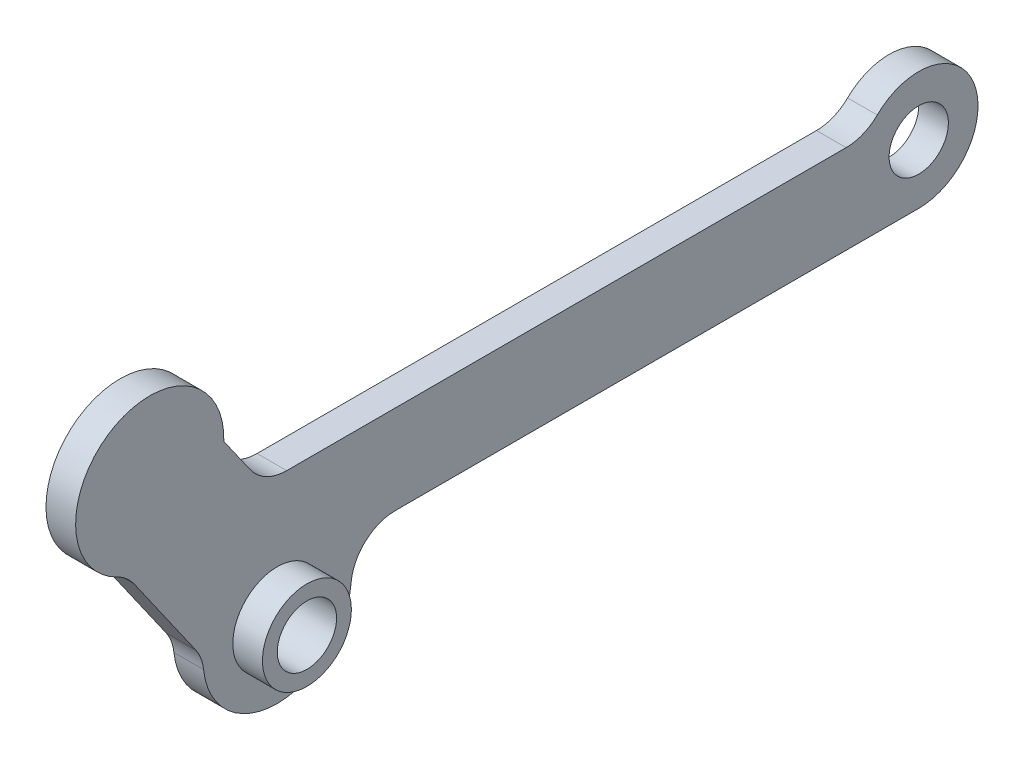
from build123d import *

# Parameters (mm, degrees)
EXTRUDE_1_DEPTH          = 2
EXTRUDE_START            = 2
SKETCH_1_4_R             = 3
EXTRUDE_2_DEPTH          = 2
CUT_EXTRUDE_1_DEPTH      = 51.160727735
CUT_EXTRUDE_1_DEPTH_BACK = 51.160727735
SKETCH_1_3_R             = 2
FILLET_1_R               = 3
SKETCH_2_R               = 2
EXTRUDE_3_DEPTH          = 2
SKETCH_2_3_R             = 1.8
EXTRUDE_4_DEPTH          = 2


with BuildPart() as part:
    # 草图1 → 凸台-拉伸1 (new body)
    with BuildSketch(Plane(origin=(0, 0, 0), x_dir=(0, 0, -1), z_dir=(1, 0, 0))):
        with BuildLine():
            Line((40.737143614, 0), (0, 0))
            Line((0, 0), (2.48051592, -3.542543867))
            ThreePointArc((2.48051592, -3.542543867), (4.165783411, -4.487079684), (5.367176995, -6))
            Line((5.367176995, -6), (44.201245229, -6))
            ThreePointArc((44.201245229, -6), (40.737143614, -4), (40.737143614, 0))
        make_face()
        with BuildLine():
            Line((2.48051592, -3.542543867), (0, 0))
            Line((0, 0), (-2.681672007, 3.829824531))
            ThreePointArc((-2.681672007, 3.829824531), (-4.811127311, -0.102785303), (-9.234888361, -0.758786959))
            Line((-9.234888361, -0.758786959), (-4.072700434, -8.131155358))
            ThreePointArc((-4.072700434, -8.131155358), (-1.94324513, -4.198545524), (2.48051592, -3.542543867))
        make_face()
        with BuildLine():
            ThreePointArc((48.201245229, -2), (45.23652141, 1.863703305), (40.737143614, 0))
            Line((40.737143614, 0), (44.201245229, 0))
            ThreePointArc((44.201245229, 0), (45.615458792, -0.585786438), (46.201245229, -2))
            ThreePointArc((46.201245229, -2), (45.615458792, -3.414213562), (44.201245229, -4))
            Line((44.201245229, -4), (44.201245229, -6))
            ThreePointArc((44.201245229, -6), (47.029672354, -4.828427125), (48.201245229, -2))
        make_face()
        with BuildLine():
            Line((44.201245229, 0), (40.737143614, 0))
            ThreePointArc((40.737143614, 0), (40.737143614, -4), (44.201245229, -6))
            Line((44.201245229, -6), (44.201245229, -4))
            ThreePointArc((44.201245229, -4), (42.201245229, -2), (44.201245229, 0))
        make_face()
        with BuildLine():
            ThreePointArc((5.367176995, -6), (4.165783411, -4.487079684), (2.48051592, -3.542543867))
            Line((2.48051592, -3.542543867), (4.201245229, -6))
            Line((4.201245229, -6), (5.367176995, -6))
        make_face()
        with BuildLine():
            Line((4.201245229, -6), (2.48051592, -3.542543867))
            ThreePointArc((2.48051592, -3.542543867), (-1.94324513, -4.198545524), (-4.072700434, -8.131155358))
            Line((-4.072700434, -8.131155358), (-2.351971125, -10.588611491))
            Line((-2.351971125, -10.588611491), (-1.532819081, -10.015035054))
            ThreePointArc((-1.532819081, -10.015035054), (-0.796092257, -5.836849613), (3.382093185, -6.573576436))
            Line((3.382093185, -6.573576436), (4.201245229, -6))
        make_face()
        with BuildLine():
            ThreePointArc((-9.234888361, -0.758786959), (-4.811127311, -0.102785303), (-2.681672007, 3.829824531))
            Line((-2.681672007, 3.829824531), (-4.402401316, 6.287280664))
            Line((-4.402401316, 6.287280664), (-6.040705405, 5.140127792))
            ThreePointArc((-6.040705405, 5.140127792), (-5.771575592, 4.594386518), (-5.679009493, 3.992974919))
            ThreePointArc((-5.679009493, 3.992974919), (-7.077597894, 2.085541017), (-9.317313582, 2.845822046))
            Line((-9.317313582, 2.845822046), (-10.95561767, 1.698669174))
            Line((-10.95561767, 1.698669174), (-9.234888361, -0.758786959))
        make_face()
        with BuildLine():
            Line((-4.402401316, 6.287280664), (-2.681672007, 3.829824531))
            ThreePointArc((-2.681672007, 3.829824531), (-2.679675166, 3.911388863), (-2.679009493, 3.992974919))
            ThreePointArc((-2.679009493, 3.992974919), (-10.613341245, 8.041394014), (-9.234888361, -0.758786959))
            Line((-9.234888361, -0.758786959), (-10.95561767, 1.698669174))
            Line((-10.95561767, 1.698669174), (-9.317313582, 2.845822046))
            ThreePointArc((-9.317313582, 2.845822046), (-8.826162366, 5.631279008), (-6.040705405, 5.140127792))
            Line((-6.040705405, 5.140127792), (-4.402401316, 6.287280664))
        make_face()
        with BuildLine():
            ThreePointArc((46.201245229, -2), (45.615458792, -0.585786438), (44.201245229, 0))
            Line((44.201245229, 0), (44.201245229, -4))
            ThreePointArc((44.201245229, -4), (45.615458792, -3.414213562), (46.201245229, -2))
        make_face()
        with BuildLine():
            Line((44.201245229, -4), (44.201245229, 0))
            ThreePointArc((44.201245229, 0), (42.201245229, -2), (44.201245229, -4))
        make_face()
        with BuildLine():
            Line((5.367176995, -6), (4.201245229, -6))
            Line((4.201245229, -6), (3.382093185, -6.573576436))
            ThreePointArc((3.382093185, -6.573576436), (3.785787904, -7.392188347), (3.924637052, -8.294305745))
            ThreePointArc((3.924637052, -8.294305745), (1.826754451, -11.155456598), (-1.532819081, -10.015035054))
            Line((-1.532819081, -10.015035054), (-2.351971125, -10.588611491))
            Line((-2.351971125, -10.588611491), (-4.072700434, -8.131155358))
            ThreePointArc((-4.072700434, -8.131155358), (0.843050996, -13.293640073), (5.924637052, -8.294305745))
            ThreePointArc((5.924637052, -8.294305745), (5.783273678, -7.113776143), (5.367176995, -6))
        make_face()
        with BuildLine():
            ThreePointArc((3.924637052, -8.294305745), (3.785787904, -7.392188347), (3.382093185, -6.573576436))
            Line((3.382093185, -6.573576436), (2.562941141, -7.147152873))
            ThreePointArc((2.562941141, -7.147152873), (2.832070954, -7.692894146), (2.924637052, -8.294305745))
            ThreePointArc((2.924637052, -8.294305745), (1.526048651, -10.201739647), (-0.713667036, -9.441458618))
            Line((-0.713667036, -9.441458618), (-1.532819081, -10.015035054))
            ThreePointArc((-1.532819081, -10.015035054), (1.826754451, -11.155456598), (3.924637052, -8.294305745))
        make_face()
        with BuildLine():
            Line((2.562941141, -7.147152873), (3.382093185, -6.573576436))
            ThreePointArc((3.382093185, -6.573576436), (-0.796092257, -5.836849613), (-1.532819081, -10.015035054))
            Line((-1.532819081, -10.015035054), (-0.713667036, -9.441458618))
            ThreePointArc((-0.713667036, -9.441458618), (-0.222515821, -6.656001657), (2.562941141, -7.147152873))
        make_face()
        with BuildLine():
            ThreePointArc((-5.679009493, 3.992974919), (-5.771575592, 4.594386518), (-6.040705405, 5.140127792))
            Line((-6.040705405, 5.140127792), (-9.317313582, 2.845822046))
            ThreePointArc((-9.317313582, 2.845822046), (-7.077597894, 2.085541017), (-5.679009493, 3.992974919))
        make_face()
        with BuildLine():
            Line((-9.317313582, 2.845822046), (-6.040705405, 5.140127792))
            ThreePointArc((-6.040705405, 5.140127792), (-8.826162366, 5.631279008), (-9.317313582, 2.845822046))
        make_face()
        with BuildLine():
            ThreePointArc((2.924637052, -8.294305745), (2.832070954, -7.692894146), (2.562941141, -7.147152873))
            Line((2.562941141, -7.147152873), (-0.713667036, -9.441458618))
            ThreePointArc((-0.713667036, -9.441458618), (1.526048651, -10.201739647), (2.924637052, -8.294305745))
        make_face()
        with BuildLine():
            Line((-0.713667036, -9.441458618), (2.562941141, -7.147152873))
            ThreePointArc((2.562941141, -7.147152873), (-0.222515821, -6.656001657), (-0.713667036, -9.441458618))
        make_face()
    extrude(amount=EXTRUDE_1_DEPTH)

    # 草图1<4> → 凸台-拉伸2 (add)
    with BuildSketch(Plane(origin=(0, 0, 0), x_dir=(0, 0, -1), z_dir=(1, 0, 0)).offset(EXTRUDE_START)):
        with Locations((0.924637052, -8.294305745)):
            Circle(SKETCH_1_4_R)
    extrude(amount=EXTRUDE_2_DEPTH)

    # 草图1<3> → 切除-拉伸1 (cut, two sides: drawn at the far end of the back side and taken through both)
    with BuildSketch(Plane(origin=(0, 0, 0), x_dir=(0, 0, -1), z_dir=(1, 0, 0)).offset(-CUT_EXTRUDE_1_DEPTH_BACK)):
        with Locations((-7.679009493, 3.992974919)):
            Circle(SKETCH_1_3_R)
        with Locations((44.201245229, -2)):
            Circle(SKETCH_1_3_R)
        with Locations((0.924637052, -8.294305745)):
            Circle(SKETCH_1_3_R)
    extrude(amount=CUT_EXTRUDE_1_DEPTH + CUT_EXTRUDE_1_DEPTH_BACK, mode=Mode.SUBTRACT)

    # 圆角1
    fillet_1_edges = [part.edges().sort_by_distance(p)[0] for p in [
        (1, -6, -5.367176995),
        (1, 0, 0),
        (1, 0, -40.737143614),
        (1, -0.758786959, 9.234888361),
        (1, -8.131155358, 4.072700434),
    ]]
    fillet(fillet_1_edges, radius=FILLET_1_R)

    # 草图2 → 凸台-拉伸3 (add)
    with BuildSketch(Plane.ZY):
        with Locations((7.679009493, 3.992974919)):
            Circle(SKETCH_2_R)
    extrude(amount=-EXTRUDE_3_DEPTH)

    # 草图2<3> → 凸台-拉伸4 (add)
    with BuildSketch(Plane.ZY):
        with Locations(Location((7.679009493, 3.992974919, 0), (0, 0, 180))):
            Circle(SKETCH_2_3_R)
    extrude(amount=EXTRUDE_4_DEPTH)


solid = part.part
